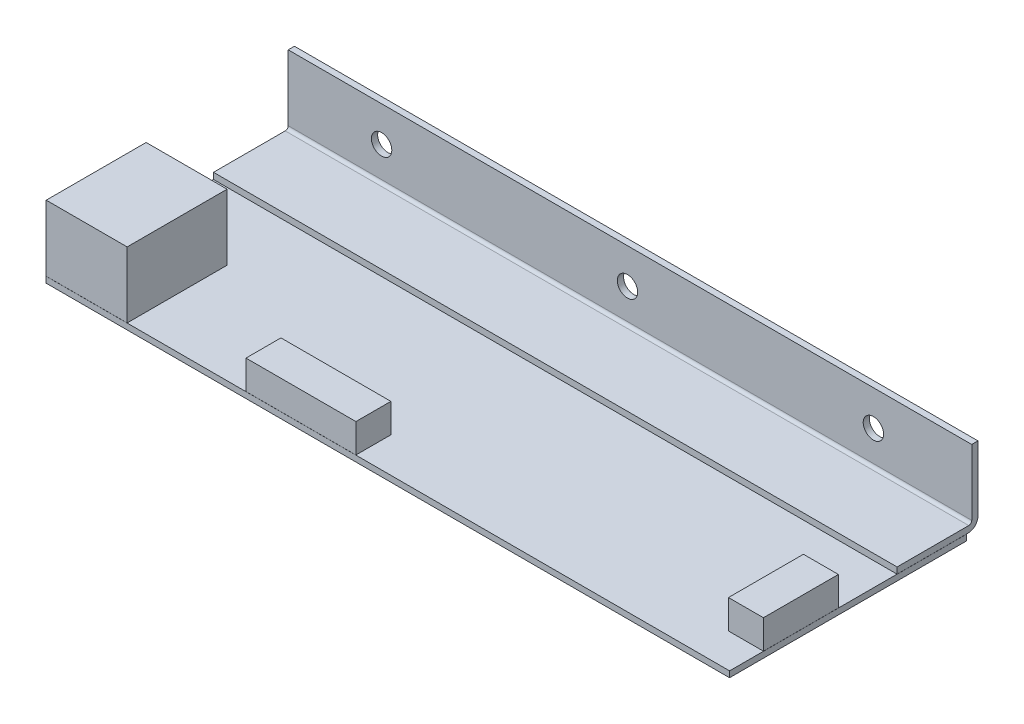
from build123d import *
from OCP.BRepFilletAPI import BRepFilletAPI_MakeFillet

# Parameters (mm, degrees)
BOSS_EXTRUDE1_DEPTH            = 86.868
FILLET1_R1                     = 2.54
FILLET1_R2                     = 0.762
SKETCH2_W                      = 173.736
SKETCH2_H                      = 60.2234
BOSS_EXTRUDE2_DEPTH            = 1.524
F_6_0_204_DIAMETER_HOLE1_D     = 5.1816
F_6_0_204_DIAMETER_HOLE1_DEPTH = 25.4
F_6_0_204_DIAMETER_HOLE1_TIP   = 1.556709692
SKETCH6_W                      = 8.89
SKETCH6_H                      = 19.05
SKETCH6_W_2                    = 27.94
SKETCH6_H_2                    = 8.89
BOSS_EXTRUDE3_DEPTH            = 7.366
SKETCH7_W                      = 20.574
SKETCH7_H                      = 25.4
BOSS_EXTRUDE4_DEPTH            = 16.7386
SKETCH8_W                      = 9.173483792
SKETCH8_H                      = 11.456594165
CUT_EXTRUDE1_DEPTH             = 14.9606
SKETCH9_R                      = 2.54
BOSS_EXTRUDE5_DEPTH            = 2.159
FILLET2_R                      = 0.762
LPATTERN1_COUNT                = 12
LPATTERN1_PITCH                = 12.7
FILLET2_OF_LPATTERN1_R         = 0.762
SKETCH10_W                     = 17.683529791
SKETCH10_H                     = 0.0254
CUT_EXTRUDE3_DEPTH             = 0.0254


with BuildPart() as part:
    # Sketch1 → Boss-Extrude1 (new, symmetric)
    with BuildSketch(Plane(origin=(0, 0, 0), x_dir=(0, 0, -1), z_dir=(1, 0, 0))):
        Polygon((0, 0), (0, 19.05), (-1.5875, 19.05), (-1.5875, 1.5875), (-20.574, 1.5875), (-20.574, 0), align=None)
    extrude(amount=BOSS_EXTRUDE1_DEPTH, both=True)

    # Fillet1: one fillet with a radius per group of edges: ONE call of the kernel's fillet builder (fillet() takes one radius for all edges)
    fillet1_edges_1 = [part.edges().sort_by_distance(p)[0] for p in [
        (0, 0, 0),
    ]]
    fillet1_edges_2 = [part.edges().sort_by_distance(p)[0] for p in [
        (0, 1.5875, 1.5875),
    ]]
    fillet1 = BRepFilletAPI_MakeFillet(part.part.solid().wrapped)
    for e in fillet1_edges_1:
        fillet1.Add(FILLET1_R1, e.wrapped)
    for e in fillet1_edges_2:
        fillet1.Add(FILLET1_R2, e.wrapped)
    add(Compound.cast(fillet1.Shape()), mode=Mode.REPLACE)

    # Sketch2 → Boss-Extrude2 (add)
    with BuildSketch(Plane.XZ):
        with Locations((0, 33.0327)):
            Rectangle(SKETCH2_W, SKETCH2_H)
    extrude(amount=BOSS_EXTRUDE2_DEPTH)

    # #6 (0.204) Diameter Hole1
    with Locations(Plane(origin=(0, 0, 0), x_dir=(-1, 0, 0), z_dir=(0, 0, -1))):
        with Locations((-61.868, 10.1092), (0.632000006, 10.1092), (63.132, 10.1092)):
            Hole(F_6_0_204_DIAMETER_HOLE1_D / 2, depth=F_6_0_204_DIAMETER_HOLE1_DEPTH)
            with Locations((0, 0, -(F_6_0_204_DIAMETER_HOLE1_DEPTH + F_6_0_204_DIAMETER_HOLE1_TIP / 2))):  # 118° drill point
                Cone(0, F_6_0_204_DIAMETER_HOLE1_D / 2, F_6_0_204_DIAMETER_HOLE1_TIP, mode=Mode.SUBTRACT)

    # Sketch6 → Boss-Extrude3 (add)
    with BuildSketch(Plane(origin=(0, 0, 0), x_dir=(1, 0, 0), z_dir=(0, 1, 0))):
        with Locations((82.3976, -44.9834)):
            Rectangle(SKETCH6_W, SKETCH6_H)
        with Locations((-22.098, -58.674)):
            Rectangle(SKETCH6_W_2, SKETCH6_H_2)
    extrude(amount=BOSS_EXTRUDE3_DEPTH)

    # Sketch7 → Boss-Extrude4 (add)
    with BuildSketch(Plane(origin=(0, 0, 0), x_dir=(1, 0, 0), z_dir=(0, 1, 0))):
        with Locations((-76.5556, -50.419)):
            Rectangle(SKETCH7_W, SKETCH7_H)
    extrude(amount=BOSS_EXTRUDE4_DEPTH)

    # Sketch8 → Cut-Extrude1 (cut)
    with BuildSketch(Plane.ZY.offset(86.8426)):
        with Locations((44.708525183, 8.103120798)):
            Rectangle(SKETCH8_W, SKETCH8_H)
        with Locations((56.129474817, 8.103120798)):
            Rectangle(SKETCH8_W, SKETCH8_H)
    extrude(amount=-CUT_EXTRUDE1_DEPTH, mode=Mode.SUBTRACT)

    # Sketch9 → Boss-Extrude5 (add)
    with BuildSketch(Plane.XZ.offset(1.524)):
        with Locations((69.088, 7.62)):
            Circle(SKETCH9_R)
    boss_extrude5 = extrude(amount=BOSS_EXTRUDE5_DEPTH)

    # Fillet2
    fillet2_edges = [part.edges().sort_by_distance(p)[0] for p in [
        (66.548, -3.683, 7.62),
    ]]
    fillet(fillet2_edges, radius=FILLET2_R)

    # LPattern1: Boss-Extrude5 ×12
    with Locations(*[(-i * LPATTERN1_PITCH, 0, 0) for i in range(1, LPATTERN1_COUNT)]):
        add(boss_extrude5)

    # Fillet2 of LPattern1
    fillet2_of_lpattern1_edges = [part.edges().sort_by_distance(p)[0] for p in [
        (53.848, -3.683, 7.62),
        (41.148, -3.683, 7.62),
        (28.448, -3.683, 7.62),
        (15.748, -3.683, 7.62),
        (3.048, -3.683, 7.62),
        (-9.652, -3.683, 7.62),
        (-22.352, -3.683, 7.62),
        (-35.052, -3.683, 7.62),
        (-47.752, -3.683, 7.62),
        (-60.452, -3.683, 7.62),
        (-73.152, -3.683, 7.62),
    ]]
    fillet(fillet2_of_lpattern1_edges, radius=FILLET2_OF_LPATTERN1_R)

    # Sketch10 → Cut-Extrude3 (cut)
    with BuildSketch(Plane(origin=(86.868, 0, 0), x_dir=(0, 0, -1), z_dir=(1, 0, 0))):
        with Locations((-11.762764896, -0.0127)):
            Rectangle(SKETCH10_W, SKETCH10_H)
    cut_extrude3 = extrude(amount=-CUT_EXTRUDE3_DEPTH, mode=Mode.SUBTRACT)

    # Mirror1: Cut-Extrude3 across plane
    add(cut_extrude3.mirror(Plane(origin=(0, 0, 0), x_dir=(0, 0, 1), z_dir=(1, 0, 0))), mode=Mode.SUBTRACT)


solid = part.part
